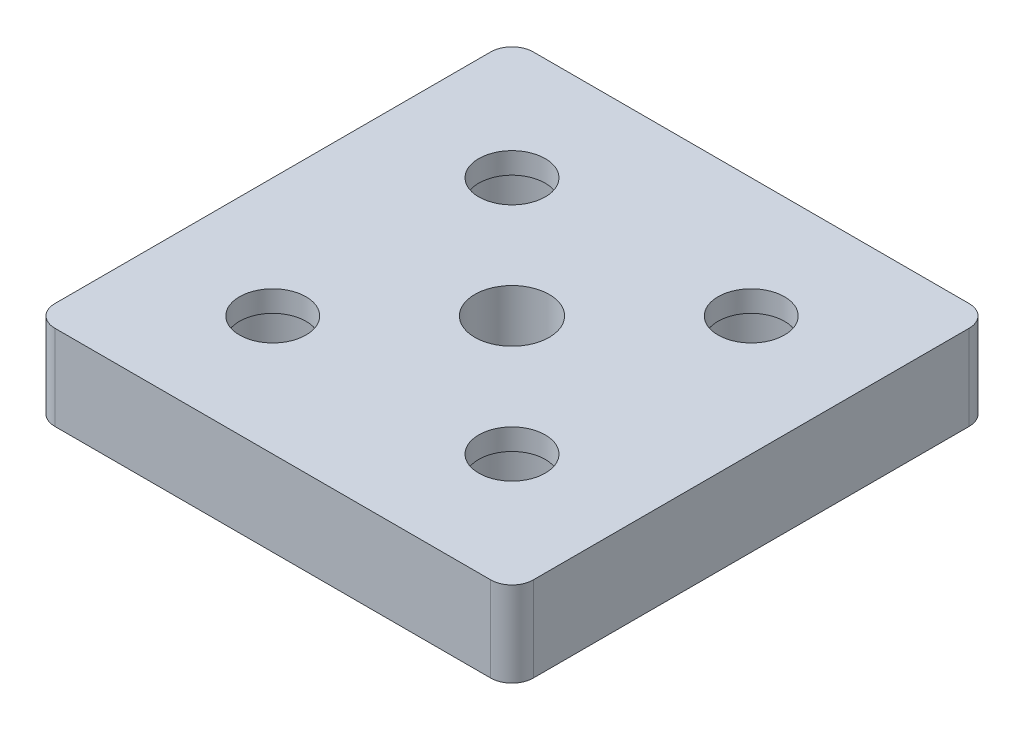
from build123d import *

# Parameters (mm, degrees)
SKETCH_1_R              = 6.25
EXTRUDE_1_DEPTH         = 16
SKETCH_3_R              = 9.25
CUT_EXTRUDE_1_DEPTH     = 12
HOLE_WIZARD_M16_1_D     = 14
HOLE_WIZARD_M16_1_DEPTH = 38
HOLE_WIZARD_M16_1_TIP   = 4.206024333


with BuildPart() as part:
    # 草图1 → 凸台-拉伸1 (new body)
    with BuildSketch(Plane(origin=(0, 0, 0), x_dir=(1, 0, 0), z_dir=(0, 1, 0))):
        with BuildLine():
            Line((-41, 0), (41, 0))
            ThreePointArc((41, 0), (43.828427125, 1.171572875), (45, 4))
            Line((45, 4), (45, 86))
            ThreePointArc((45, 86), (43.828427125, 88.828427125), (41, 90))
            Line((41, 90), (-41, 90))
            ThreePointArc((-41, 90), (-43.828427125, 88.828427125), (-45, 86))
            Line((-45, 86), (-45, 4))
            ThreePointArc((-45, 4), (-43.828427125, 1.171572875), (-41, 0))
        make_face()
        with Locations(Location((22.5, 67.5, 0), (0, 0, 270))):
            Circle(SKETCH_1_R, mode=Mode.SUBTRACT)
        with Locations(Location((-22.5, 67.5, 0), (0, 0, 270))):
            Circle(SKETCH_1_R, mode=Mode.SUBTRACT)
        with Locations(Location((-22.5, 22.5, 0), (0, 0, 270))):
            Circle(SKETCH_1_R, mode=Mode.SUBTRACT)
        with Locations(Location((22.5, 22.5, 0), (0, 0, 270))):
            Circle(SKETCH_1_R, mode=Mode.SUBTRACT)
    extrude(amount=EXTRUDE_1_DEPTH)

    # 草图3 → 切除-拉伸1 (cut)
    with BuildSketch(Plane.XZ):
        with Locations(Location((22.5, -22.5, 0), (0, 0, 270))):
            Circle(SKETCH_3_R)
        with Locations(Location((22.5, -67.5, 0), (0, 0, 270))):
            Circle(SKETCH_3_R)
        with Locations(Location((-22.5, -67.5, 0), (0, 0, 270))):
            Circle(SKETCH_3_R)
        with Locations(Location((-22.5, -22.5, 0), (0, 0, 270))):
            Circle(SKETCH_3_R)
    extrude(amount=-CUT_EXTRUDE_1_DEPTH, mode=Mode.SUBTRACT)

    # M16 螺纹孔1
    with Locations(Plane(origin=(0, 16, -45), x_dir=(0, 0, 1), z_dir=(0, 1, 0))):
        with Locations((0, 0)):
            Hole(HOLE_WIZARD_M16_1_D / 2, depth=HOLE_WIZARD_M16_1_DEPTH)
            with Locations((0, 0, -(HOLE_WIZARD_M16_1_DEPTH + HOLE_WIZARD_M16_1_TIP / 2))):  # 118° drill point
                Cone(0, HOLE_WIZARD_M16_1_D / 2, HOLE_WIZARD_M16_1_TIP, mode=Mode.SUBTRACT)


solid = part.part
